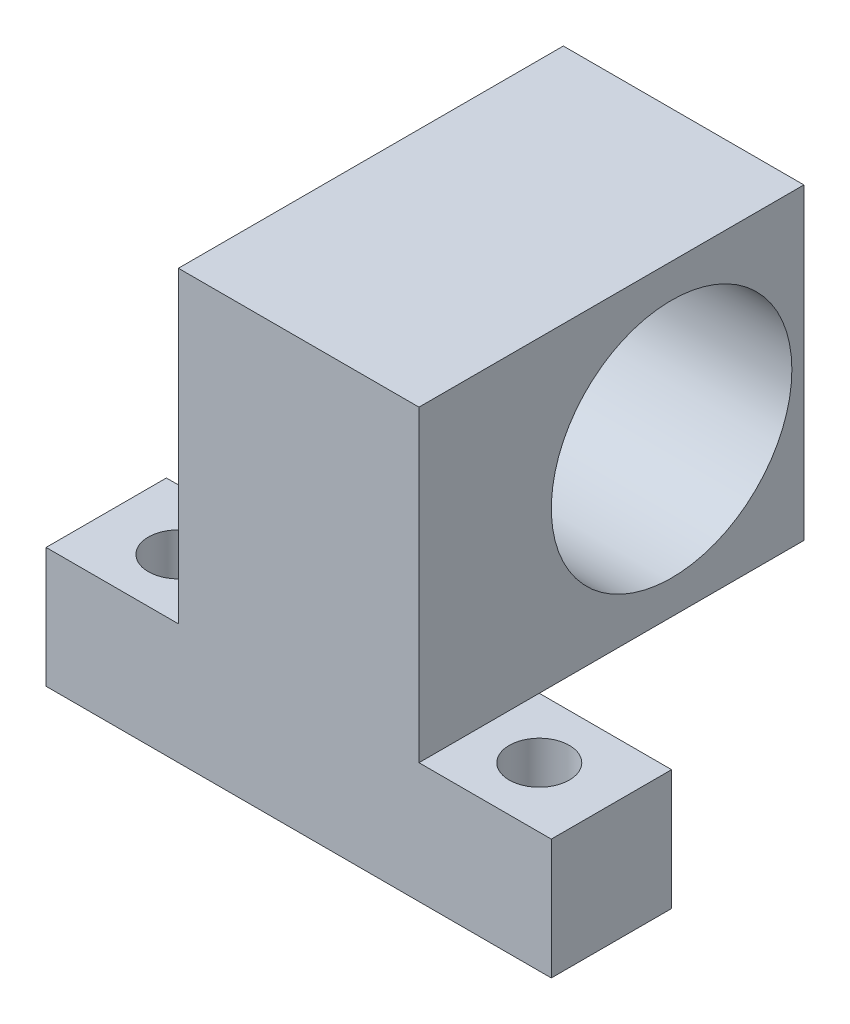
from build123d import *

# Parameters (mm, degrees)
SKETCH1_W           = 21
SKETCH1_H           = 5
BOSS_EXTRUDE1_DEPTH = 5
SKETCH2_W           = 10
SKETCH2_H           = 16
BOSS_EXTRUDE2_DEPTH = 12.8
SKETCH3_R           = 1.25
CUT_EXTRUDE1_DEPTH  = 13
SKETCH4_R           = 5
CUT_EXTRUDE2_DEPTH  = 13


with BuildPart() as part:
    # Sketch1 → Boss-Extrude1 (new body)
    with BuildSketch(Plane.XY):
        with Locations((10.5, 2.5)):
            Rectangle(SKETCH1_W, SKETCH1_H)
    extrude(amount=BOSS_EXTRUDE1_DEPTH)

    # Sketch2 → Boss-Extrude2 (add)
    with BuildSketch(Plane(origin=(0, 5, 0), x_dir=(1, 0, 0), z_dir=(0, 1, 0))):
        with Locations((10.5, 3)):
            Rectangle(SKETCH2_W, SKETCH2_H)
    extrude(amount=BOSS_EXTRUDE2_DEPTH)

    # Sketch3 → Cut-Extrude1 (cut)
    with BuildSketch(Plane(origin=(0, 5, 0), x_dir=(1, 0, 0), z_dir=(0, 1, 0))):
        with Locations(Location((3, -2.5, 0), (0, 0, 270))):
            Circle(SKETCH3_R)
        with Locations(Location((18, -2.5, 0), (0, 0, 270))):
            Circle(SKETCH3_R)
    extrude(amount=-CUT_EXTRUDE1_DEPTH, mode=Mode.SUBTRACT)

    # Sketch4 → Cut-Extrude2 (cut)
    with BuildSketch(Plane(origin=(15.5, 0, 0), x_dir=(0, 0, -1), z_dir=(1, 0, 0))):
        with Locations((5.5, 11.4)):
            Circle(SKETCH4_R)
    extrude(amount=-CUT_EXTRUDE2_DEPTH, mode=Mode.SUBTRACT)


solid = part.part
